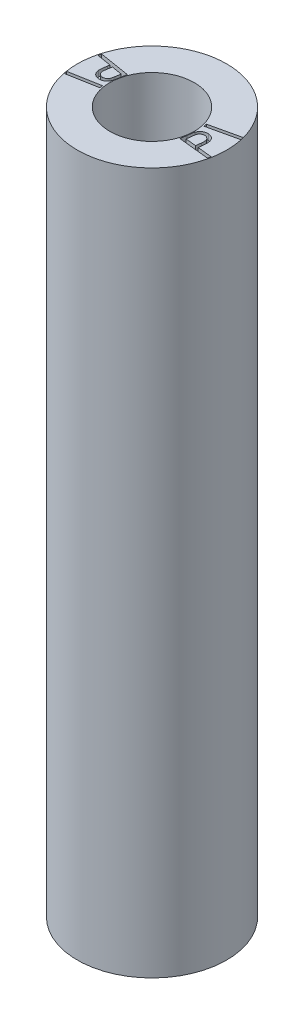
from build123d import *

# Parameters (mm, degrees)
SKETCH1_R           = 3.8
SKETCH1_R_2         = 2.15
BOSS_EXTRUDE1_DEPTH = 35.7
CUT_EXTRUDE1_DEPTH  = 0.3


with BuildPart() as part:
    # Sketch1 → Boss-Extrude1 (new body)
    with BuildSketch(Plane(origin=(0, 0, 0), x_dir=(1, 0, 0), z_dir=(0, 1, 0))):
        with Locations(Location((0, 0, 0), (0, 0, 90))):
            Circle(SKETCH1_R)
        with Locations(Location((0, 0, 0), (0, 0, 90))):
            Circle(SKETCH1_R_2, mode=Mode.SUBTRACT)
    extrude(amount=BOSS_EXTRUDE1_DEPTH)

    # Sketch2 → Cut-Extrude1 (cut)
    # profile 1 of 4: a face of its own
    with BuildSketch(Plane(origin=(0, 35.7, 0), x_dir=(1, 0, 0), z_dir=(0, 1, 0))):
        with BuildLine():
            Line((2.111656105, -0.681757882), (2.144411013, -0.370109244))
            add(Edge.make_bspline(
                [(2.144411013, -0.370109244), (2.146802183, -0.348691162), (2.15138598, -0.307633396), (2.158693119, -0.248902879), (2.165911145, -0.195653849), (2.173439795, -0.148026639), (2.181405599, -0.105945418), (2.189365932, -0.069370665), (2.196899512, -0.038121368), (2.203230185, -0.019522424), (2.206104723, -0.011077293)],
                knots=[0, 0, 0, 0, 1.417373572, 2.717059047, 3.892315439, 4.951364628, 5.887982497, 6.708448809, 7.413551636, 8, 8, 8, 8], degree=3))
            add(Edge.make_bspline(
                [(2.206104723, -0.011077293), (2.210142486, -0.000387677), (2.218120236, 0.020732699), (2.233480051, 0.050530823), (2.249714506, 0.079217068), (2.26903293, 0.105377158), (2.28975844, 0.130224476), (2.312780938, 0.153046655), (2.337556691, 0.174424753), (2.364307409, 0.193873427), (2.392778115, 0.210986132), (2.422871362, 0.225484332), (2.454400246, 0.23669106), (2.487041624, 0.245969514), (2.521307609, 0.251371473), (2.556788909, 0.254755049), (2.593708427, 0.254583895), (2.61857229, 0.252608033), (2.631282507, 0.251597988)],
                knots=[0, 0, 0, 0, 1.011284266, 1.998079665, 2.96593116, 3.927568455, 4.873724646, 5.829799179, 6.795279379, 7.770029274, 8.755528345, 9.734069651, 10.723185245, 11.716348137, 12.735145537, 13.790957307, 14.870754256, 16, 16, 16, 16], degree=3))
            add(Edge.make_bspline(
                [(2.631282507, 0.251597988), (2.644032058, 0.24997818), (2.668933898, 0.246814446), (2.705191942, 0.239067164), (2.739499602, 0.22904372), (2.771695562, 0.216250901), (2.801935318, 0.201182094), (2.830167738, 0.18375954), (2.856506904, 0.163892672), (2.880584442, 0.141642816), (2.902598289, 0.117288438), (2.922659945, 0.091347366), (2.940268337, 0.063416255), (2.955457965, 0.033787663), (2.968650724, 0.002594273), (2.978949316, -0.030497322), (2.987853849, -0.065140381), (2.991380402, -0.089158794), (2.993176538, -0.101391796)],
                knots=[0, 0, 0, 0, 1.120443029, 2.188398027, 3.229732507, 4.234008471, 5.205583901, 6.172795254, 7.123159449, 8.078367438, 9.027336717, 9.98330492, 10.934837467, 11.902358037, 12.884432561, 13.884316223, 14.922444945, 16, 16, 16, 16], degree=3))
            add(Edge.make_bspline(
                [(2.993176538, -0.101391796), (2.994230251, -0.111454082), (2.996521933, -0.133338158), (2.997952687, -0.169220751), (2.997758266, -0.210688547), (2.99653436, -0.257987318), (2.99350795, -0.310882297), (2.989330268, -0.36950307), (2.984003426, -0.433765073), (2.979373477, -0.478452172), (2.976958088, -0.501764893)],
                knots=[0, 0, 0, 0, 0.604865624, 1.315498741, 2.145858656, 3.084317767, 4.144404289, 5.313618666, 6.59854729, 8, 8, 8, 8], degree=3))
            Line((2.976958088, -0.501764893), (2.965191762, -0.613385986))
            Line((2.965191762, -0.613385986), (3.69247792, -0.689708102))
            Line((3.69247792, -0.689708102), (3.675941462, -0.846168438))
            Line((3.675941462, -0.846168438), (2.111656105, -0.681757882))
        make_face()
        with BuildLine():
            Line((2.280200776, -0.541515995), (2.811911514, -0.597167537))
            Line((2.811911514, -0.597167537), (2.843076377, -0.332902212))
            add(Edge.make_bspline(
                [(2.843076377, -0.332902212), (2.844289329, -0.319974038), (2.846633891, -0.294984657), (2.849267306, -0.258732107), (2.850574992, -0.225003014), (2.8506223, -0.193920252), (2.849446171, -0.165468856), (2.846833591, -0.139695973), (2.843533978, -0.116385305), (2.837224352, -0.089138127), (2.826277417, -0.05801598), (2.808152361, -0.023948438), (2.784508643, 0.006287227), (2.756461903, 0.032531622), (2.725026024, 0.054952555), (2.690476942, 0.072174184), (2.653338622, 0.084201266), (2.627543305, 0.088078292), (2.61442804, 0.09004951)],
                knots=[0, 0, 0, 0, 1.137510035, 2.198738341, 3.183774331, 4.093820263, 4.921124839, 5.676965373, 6.362509616, 6.981975284, 8.12447774, 9.242103714, 10.347315548, 11.470636665, 12.59656481, 13.717849775, 14.83967295, 16, 16, 16, 16], degree=3))
            add(Edge.make_bspline(
                [(2.61442804, 0.09004951), (2.601492156, 0.090867689), (2.575975574, 0.092481581), (2.537925492, 0.088020007), (2.500904783, 0.078506725), (2.46570153, 0.063177958), (2.43299178, 0.043746262), (2.404191117, 0.019855084), (2.379800983, -0.008048068), (2.363216589, -0.034756124), (2.351731956, -0.058692023), (2.344337638, -0.079917763), (2.337050019, -0.103790363), (2.329926737, -0.130456035), (2.324165305, -0.160160444), (2.318330265, -0.192568564), (2.313285026, -0.227894023), (2.310555246, -0.252437869), (2.309139579, -0.265166335)],
                knots=[0, 0, 0, 0, 1.162655522, 2.293387438, 3.425402363, 4.586027317, 5.731110208, 6.83356732, 7.933882776, 9.046497222, 9.647242429, 10.316155155, 11.063354823, 11.890427355, 12.794535371, 13.781081296, 14.849266247, 16, 16, 16, 16], degree=3))
            Line((2.309139579, -0.265166335), (2.280200776, -0.541515995))
        make_face(mode=Mode.SUBTRACT)
    # profile 2 of 4: a face of its own
    with BuildSketch(Plane(origin=(0, 35.7, 0), x_dir=(1, 0, 0), z_dir=(0, 1, 0))):
        Polygon((2.170881214, 0.473456425), (2.136218253, 0.627054682), (3.671246799, 0.973366281), (3.705909759, 0.819768024), align=None)
    # profile 3 of 4: a face of its own
    with BuildSketch(Plane(origin=(0, 35.7, 0), x_dir=(1, 0, 0), z_dir=(0, 1, 0))):
        with BuildLine():
            Line((-2.056988676, 0.799308725), (-2.108188095, 0.487660087))
            add(Edge.make_bspline(
                [(-2.108188095, 0.487660087), (-2.111708879, 0.466232817), (-2.118445766, 0.425232539), (-2.129421133, 0.36665679), (-2.139718713, 0.313480105), (-2.150281282, 0.265914926), (-2.160212249, 0.223828754), (-2.170557002, 0.187532109), (-2.179974067, 0.156559724), (-2.187465233, 0.138231414), (-2.190870387, 0.129900171)],
                knots=[0, 0, 0, 0, 1.41672968, 2.710859107, 3.888203329, 4.950446671, 5.889832269, 6.708755629, 7.413057157, 8, 8, 8, 8], degree=3))
            add(Edge.make_bspline(
                [(-2.190870387, 0.129900171), (-2.195556444, 0.11941634), (-2.204838325, 0.098650549), (-2.221929721, 0.069508001), (-2.240455136, 0.041959041), (-2.260630824, 0.016005619), (-2.28356608, -0.007341147), (-2.307553717, -0.029678541), (-2.334263373, -0.049103372), (-2.362013715, -0.067435737), (-2.391696978, -0.083048929), (-2.422778873, -0.095769744), (-2.455093773, -0.105304128), (-2.488524604, -0.111948097), (-2.523172883, -0.116205202), (-2.559155273, -0.11708093), (-2.596246189, -0.114743131), (-2.621154486, -0.111310806), (-2.633856665, -0.109560466)],
                knots=[0, 0, 0, 0, 1.008565843, 1.997711397, 2.964088398, 3.925828959, 4.881231488, 5.837542023, 6.8027058, 7.77948986, 8.758803017, 9.744916733, 10.726487241, 11.714930589, 12.737596956, 13.790702482, 14.873351644, 16, 16, 16, 16], degree=3))
            add(Edge.make_bspline(
                [(-2.633856665, -0.109560466), (-2.646618171, -0.107204254), (-2.671598778, -0.102591978), (-2.707626521, -0.092636992), (-2.741459416, -0.080586731), (-2.773228531, -0.066238595), (-2.802791732, -0.049368652), (-2.830283852, -0.030242912), (-2.855627907, -0.008737139), (-2.878770231, 0.014985273), (-2.899399946, 0.040920795), (-2.917983767, 0.068252889), (-2.933935366, 0.097479257), (-2.94758708, 0.128207774), (-2.958694781, 0.160590944), (-2.967721239, 0.194453712), (-2.973992641, 0.230009053), (-2.976403376, 0.254328418), (-2.977624193, 0.266643961)],
                knots=[0, 0, 0, 0, 1.121688944, 2.195702573, 3.227831976, 4.224598539, 5.20573391, 6.166885501, 7.116340498, 8.07565474, 9.027584121, 9.978365483, 10.930074198, 11.902608988, 12.882373339, 13.887282389, 14.930101006, 16, 16, 16, 16], degree=3))
            add(Edge.make_bspline(
                [(-2.977624193, 0.266643961), (-2.978173535, 0.276817647), (-2.979369039, 0.2989581), (-2.978416522, 0.335055248), (-2.97575293, 0.376716727), (-2.971541929, 0.424106537), (-2.965863423, 0.477242518), (-2.958062562, 0.535941987), (-2.94893467, 0.60032135), (-2.941666402, 0.644981141), (-2.937873091, 0.668289093)],
                knots=[0, 0, 0, 0, 0.604646202, 1.315859532, 2.141770145, 3.082979908, 4.139987401, 5.313936572, 6.598143075, 8, 8, 8, 8], degree=3))
            Line((-2.937873091, 0.668289093), (-2.919746589, 0.779910187))
            Line((-2.919746589, 0.779910187), (-3.647032747, 0.898845483))
            Line((-3.647032747, 0.898845483), (-3.621274033, 1.05530582))
            Line((-3.621274033, 1.05530582), (-2.056988676, 0.799308725))
        make_face()
        with BuildLine():
            Line((-2.234755603, 0.667653076), (-2.766466341, 0.754787491))
            Line((-2.766466341, 0.754787491), (-2.812895628, 0.490840175))
            add(Edge.make_bspline(
                [(-2.812895628, 0.490840175), (-2.815008197, 0.477922044), (-2.81910293, 0.452883193), (-2.823415086, 0.416473146), (-2.826657363, 0.382653714), (-2.828734553, 0.35136981), (-2.829006368, 0.322605404), (-2.828117211, 0.296281893), (-2.825997962, 0.272585261), (-2.82146303, 0.244692822), (-2.811909992, 0.212873549), (-2.795853791, 0.177447593), (-2.773735167, 0.14572244), (-2.747345259, 0.117404003), (-2.716955042, 0.093039199), (-2.682766519, 0.074626688), (-2.646499979, 0.05943945), (-2.620631779, 0.054501823), (-2.607461934, 0.051988011)],
                knots=[0, 0, 0, 0, 1.136739534, 2.20331033, 3.183538476, 4.087470488, 4.925317766, 5.680760515, 6.37425325, 6.990267555, 8.132251804, 9.248525494, 10.354270943, 11.474675275, 12.601942906, 13.718823886, 14.838622839, 16, 16, 16, 16], degree=3))
            add(Edge.make_bspline(
                [(-2.607461934, 0.051988011), (-2.594553232, 0.050310074), (-2.568992641, 0.046987581), (-2.53033584, 0.049159746), (-2.492576023, 0.056899765), (-2.456092773, 0.069822513), (-2.422214957, 0.08795422), (-2.391742809, 0.110088649), (-2.365813449, 0.136873568), (-2.347514733, 0.162509328), (-2.334999931, 0.186178026), (-2.325732889, 0.206848206), (-2.317397434, 0.230587534), (-2.308596743, 0.25697407), (-2.300834458, 0.286429563), (-2.293637242, 0.318843854), (-2.286151391, 0.353972674), (-2.282041679, 0.378564756), (-2.279912855, 0.391303416)],
                knots=[0, 0, 0, 0, 1.158878903, 2.294702534, 3.43304114, 4.587206463, 5.733290821, 6.84883061, 7.931810954, 9.043940833, 9.644510014, 10.317362802, 11.062023369, 11.887125953, 12.797502392, 13.776738287, 14.848353887, 16, 16, 16, 16], degree=3))
            Line((-2.279912855, 0.391303416), (-2.234755603, 0.667653076))
        make_face(mode=Mode.SUBTRACT)
    # profile 4 of 4: a face of its own
    with BuildSketch(Plane(origin=(0, 35.7, 0), x_dir=(1, 0, 0), z_dir=(0, 1, 0))):
        Polygon((-2.194903236, -0.321716904), (-2.166600452, -0.476587196), (-3.716257403, -0.758343006), (-3.744560187, -0.603472713), align=None)
    extrude(amount=-CUT_EXTRUDE1_DEPTH, mode=Mode.SUBTRACT)


solid = part.part
